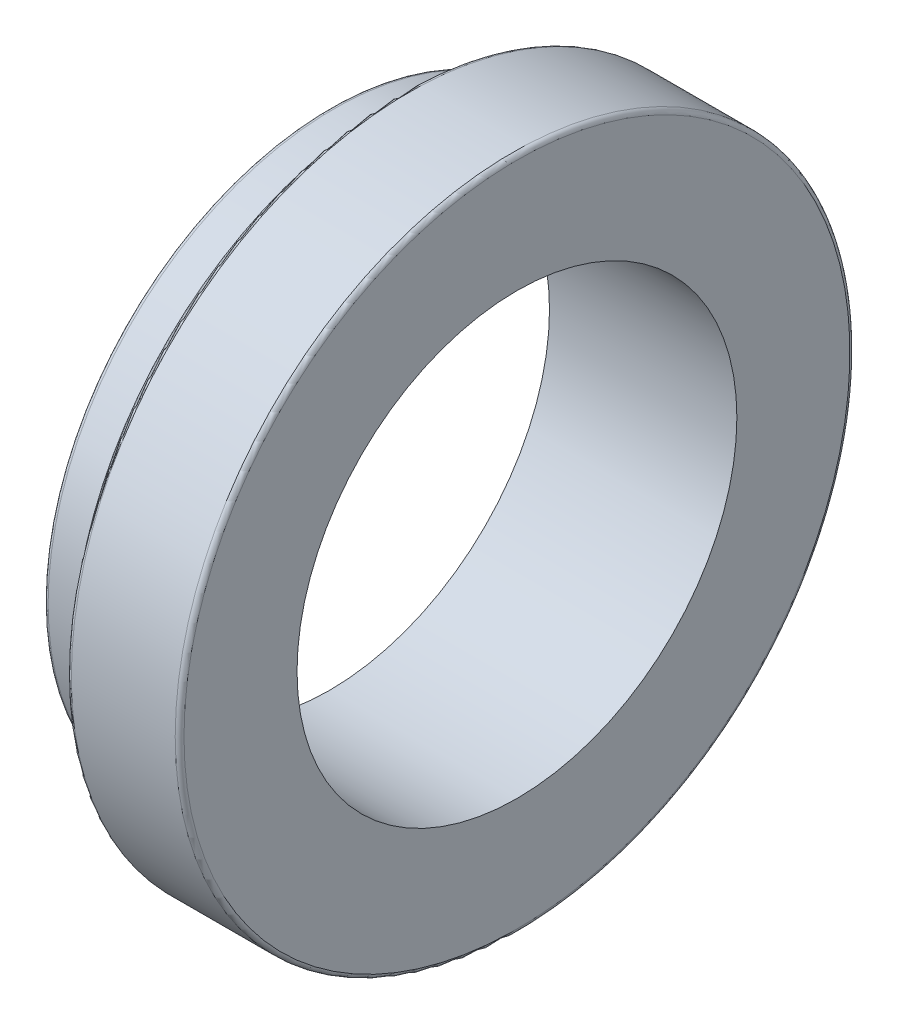
from build123d import *


with BuildPart() as part:
    # Sketch1 → Revolve1 (revolve)
    with BuildSketch(Plane.XY, mode=Mode.PRIVATE) as revolve1_sk:
        with BuildLine():
            Line((1.795946189, 31.75), (1.795946189, 40.64))
            ThreePointArc((1.795946189, 40.64), (1.981933383, 41.089012806), (2.430946189, 41.275))
            Line((2.430946189, 41.275), (10.685946189, 41.275))
            Line((10.685946189, 41.275), (10.685946189, 45.7835))
            ThreePointArc((10.685946189, 45.7835), (10.760341067, 45.963105122), (10.939946189, 46.0375))
            Line((10.939946189, 46.0375), (12.324748868, 46.0375))
            ThreePointArc((12.324748868, 46.0375), (12.50435399, 46.111894878), (12.578748868, 46.2915))
            Line((12.578748868, 46.2915), (12.578748868, 48.0695))
            ThreePointArc((12.578748868, 48.0695), (12.764736062, 48.518512806), (13.213748868, 48.7045))
            Line((13.213748868, 48.7045), (28.211946189, 48.7045))
            ThreePointArc((28.211946189, 48.7045), (28.660958995, 48.518512806), (28.846946189, 48.0695))
            Line((28.846946189, 48.0695), (28.846946189, 31.75))
            Line((28.846946189, 31.75), (1.795946189, 31.75))
        make_face()
    revolve(revolve1_sk.sketch.rotate(Axis((0, 0, 0), (1, 0, 0)), 90), axis=Axis((0, 0, 0), (1, 0, 0)))


solid = part.part
